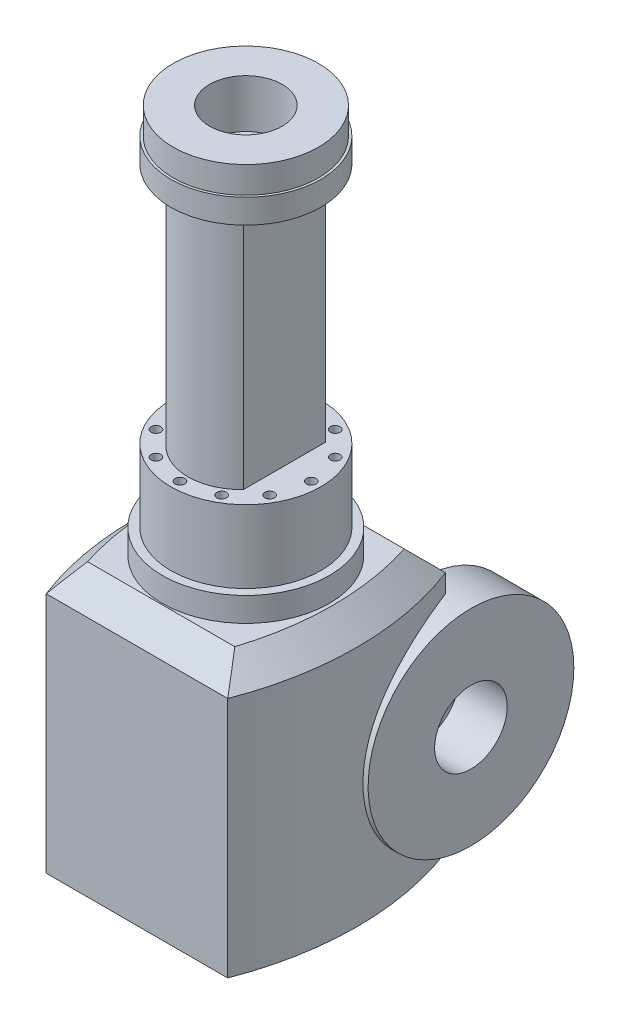
from build123d import *

# Parameters (mm, degrees)
BOSS_EXTRUDE1_DEPTH = 100
BOSS_EXTRUDE2_DEPTH = 10
BOSS_EXTRUDE2_DRAFT = 45
SKETCH3_R           = 34.5
BOSS_EXTRUDE3_DEPTH = 10
SKETCH4_R           = 31
BOSS_EXTRUDE4_DEPTH = 30
SKETCH5_R           = 2
CUT_EXTRUDE1_DEPTH  = 5
CIRPATTERN1_COUNT   = 12
BOSS_EXTRUDE5_DEPTH = 100
SKETCH7_R           = 31
BOSS_EXTRUDE6_DEPTH = 10
SKETCH8_R           = 30
BOSS_EXTRUDE7_DEPTH = 11
SKETCH10_R          = 42.5
BOSS_EXTRUDE8_DEPTH = 10.5
BOSS_EXTRUDE9_DEPTH = 55
SKETCH12_R          = 15
CUT_EXTRUDE2_DEPTH  = 20
SKETCH13_R          = 15
CUT_EXTRUDE3_DEPTH  = 20
L_EK1_SCALE         = 0.2


with BuildPart() as part:
    # Sketch1 → Boss-Extrude1 (new body)
    with BuildSketch(Plane(origin=(0, 0, 0), x_dir=(1, 0, 0), z_dir=(0, 1, 0))):
        with BuildLine():
            Line((-37.5, 45), (37.5, 45))
            ThreePointArc((37.5, 45), (45.880962103, 0), (37.5, -45))
            Line((37.5, -45), (-37.5, -45))
            ThreePointArc((-37.5, -45), (-45.880962103, 0), (-37.5, 45))
        make_face()
    extrude(amount=BOSS_EXTRUDE1_DEPTH)


with BuildPart() as boss_extrude2_tool:
    # Sketch2 → Boss-Extrude2 (with draft: the straight prism first)
    with BuildSketch(Plane(origin=(0, 100, 0), x_dir=(1, 0, 0), z_dir=(0, 1, 0))):
        with BuildLine():
            Line((-37.5, -45), (37.5, -45))
            ThreePointArc((37.5, -45), (45.880962103, 0), (37.5, 45))
            Line((37.5, 45), (-37.5, 45))
            ThreePointArc((-37.5, 45), (-45.880962103, 0), (-37.5, -45))
        make_face()
    extrude(amount=BOSS_EXTRUDE2_DEPTH)
    # Boss-Extrude2: the draft: its side faces are tilted about the plane it starts from
    boss_extrude2_sides = [boss_extrude2_tool.faces().sort_by_distance(p)[0] for p in [
        (0, 105, -45),
        (-45.880962103, 105, 0),
        (0, 105, 45),
        (45.880962103, 105, 0),
    ]]
    draft(boss_extrude2_sides, Plane(origin=(0, 100, 0), x_dir=(1, 0, 0), z_dir=(0, 1, 0)), BOSS_EXTRUDE2_DRAFT)


with BuildPart() as part_1:
    add(part.part)

    # Boss-Extrude2: add boss_extrude2_tool
    add(boss_extrude2_tool.part)

    # Sketch3 → Boss-Extrude3 (add)
    with BuildSketch(Plane(origin=(0, 110, 0), x_dir=(1, 0, 0), z_dir=(0, 1, 0))):
        with Locations(Location((0, 0, 0), (0, 0, 270))):
            Circle(SKETCH3_R)
    extrude(amount=BOSS_EXTRUDE3_DEPTH)

    # Sketch4 → Boss-Extrude4 (add)
    with BuildSketch(Plane(origin=(0, 120, 0), x_dir=(1, 0, 0), z_dir=(0, 1, 0))):
        with Locations(Location((0, 0, 0), (0, 0, 270))):
            Circle(SKETCH4_R)
    extrude(amount=BOSS_EXTRUDE4_DEPTH)

    # Sketch5 → Cut-Extrude1 (cut)
    with BuildSketch(Plane(origin=(0, 150, 0), x_dir=(1, 0, 0), z_dir=(0, 1, 0))):
        with Locations(Location((27, 0, 0), (0, 0, 270))):
            Circle(SKETCH5_R)
    cut_extrude1 = extrude(amount=-CUT_EXTRUDE1_DEPTH, mode=Mode.SUBTRACT)

    # CirPattern1: Cut-Extrude1 ×12 about axis
    cirpattern1_axis = Axis((-0.112852665, 0, 0), (0, 1, 0))
    for i in range(1, CIRPATTERN1_COUNT):
        add(cut_extrude1.rotate(cirpattern1_axis, i * 360 / CIRPATTERN1_COUNT), mode=Mode.SUBTRACT)

    # Sketch6 → Boss-Extrude5 (add)
    with BuildSketch(Plane(origin=(0, 150, 0), x_dir=(1, 0, 0), z_dir=(0, 1, 0))):
        with BuildLine():
            Line((-16, -17), (-16, 17))
            ThreePointArc((-16, 17), (0, 23.900331129), (16, 17))
            Line((16, 17), (16, -17))
            ThreePointArc((16, -17), (0, -23.900331129), (-16, -17))
        make_face()
    extrude(amount=BOSS_EXTRUDE5_DEPTH)

    # Sketch7 → Boss-Extrude6 (add)
    with BuildSketch(Plane(origin=(0, 250, 0), x_dir=(1, 0, 0), z_dir=(0, 1, 0))):
        with Locations(Location((0, 0, 0), (0, 0, 270))):
            Circle(SKETCH7_R)
    extrude(amount=BOSS_EXTRUDE6_DEPTH)

    # Sketch8 → Boss-Extrude7 (add)
    with BuildSketch(Plane(origin=(0, 260, 0), x_dir=(1, 0, 0), z_dir=(0, 1, 0))):
        with Locations(Location((0, 0, 0), (0, 0, 270))):
            Circle(SKETCH8_R)
    extrude(amount=BOSS_EXTRUDE7_DEPTH)

    # Sketch10 → Boss-Extrude8 (add, symmetric)
    with BuildSketch(Plane(origin=(37.5, 0, 0), x_dir=(0, 0, -1), z_dir=(1, 0, 0))):
        with Locations(Location((45, 50, 0), (0, 0, 90))):
            Circle(SKETCH10_R)
    extrude(amount=BOSS_EXTRUDE8_DEPTH, both=True)

    # Sketch11 → Boss-Extrude9 (add)
    with BuildSketch(Plane.ZY.offset(-27)):
        with BuildLine():
            Line((-45, 30), (-75, 30))
            ThreePointArc((-75, 30), (-82.639320225, 50), (-75, 70))
            Line((-75, 70), (-45, 70))
            Line((-45, 70), (-45, 30))
        make_face()
    extrude(amount=BOSS_EXTRUDE9_DEPTH)

    # Sketch12 → Cut-Extrude2 (cut)
    with BuildSketch(Plane(origin=(0, 271, 0), x_dir=(1, 0, 0), z_dir=(0, 1, 0))):
        with Locations(Location((0, 0, 0), (0, 0, 270))):
            Circle(SKETCH12_R)
    extrude(amount=-CUT_EXTRUDE2_DEPTH, mode=Mode.SUBTRACT)

    # Sketch13 → Cut-Extrude3 (cut)
    with BuildSketch(Plane(origin=(48, 0, 0), x_dir=(0, 0, -1), z_dir=(1, 0, 0))):
        with Locations((45, 50)):
            Circle(SKETCH13_R)
    extrude(amount=-CUT_EXTRUDE3_DEPTH, mode=Mode.SUBTRACT)


with BuildPart() as part_2:
    # Ölçek1: scaled about (1.834934624, 84.278783532, -6.572274509)
    add(part_1.part.scale(L_EK1_SCALE).moved(Location((1.467947699, 67.423026826, -5.257819607))))


solid = part_2.part
